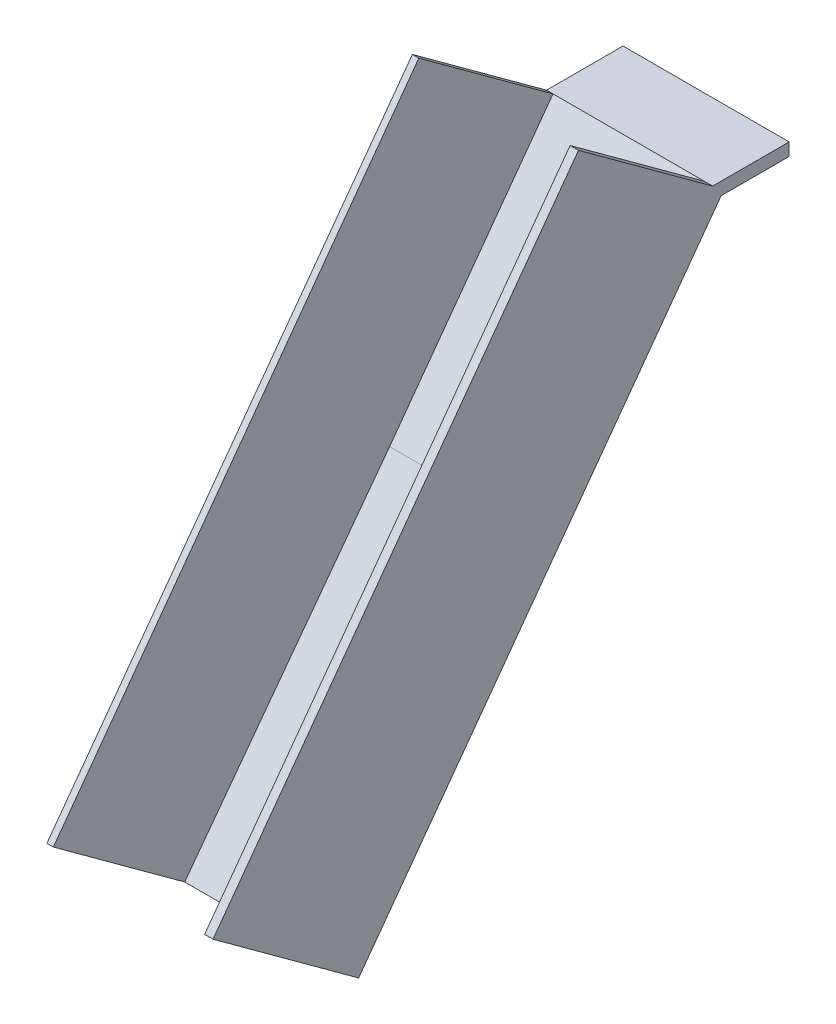
from build123d import *

# Parameters (mm, degrees)
BOSS_EXTRUDE1_DEPTH = 40
SKETCH4_W           = 1.560342198
SKETCH4_H           = 149.198591979
BOSS_EXTRUDE2_DEPTH = 40
SKETCH6_W           = 2.027300843
SKETCH6_H           = 149.198591979
BOSS_EXTRUDE3_DEPTH = 40


with BuildPart() as part:
    # Sketch3 → Boss-Extrude1 (new body)
    with BuildSketch(Plane(origin=(0, 0, 0), x_dir=(0, 0, -1), z_dir=(1, 0, 0))):
        Polygon((0, 0), (39.348289754, 53.871692839), (57.75585878, 53.871692839), (57.75585878, 50.831910798), (41.374811114, 50.831910798), (-45.883583059, -68.633444315), (-49.329231032, -66.116717112), align=None)
    extrude(amount=BOSS_EXTRUDE1_DEPTH)

    # Sketch4 → Boss-Extrude2 (add)
    with BuildSketch(Plane(origin=(0, 0, 0), x_dir=(1, 0, 0), z_dir=(0, 0.5898261654750604, 0.8075302437190738))):
        with Locations((0.780171099, -7.887623879)):
            Rectangle(SKETCH4_W, SKETCH4_H)
    extrude(amount=BOSS_EXTRUDE2_DEPTH)

    # Sketch6 → Boss-Extrude3 (add)
    with BuildSketch(Plane(origin=(0, 0, 0), x_dir=(1, 0, 0), z_dir=(0, 0.5898261654750604, 0.8075302437190738))):
        with Locations((38.986349578, -7.887623879)):
            Rectangle(SKETCH6_W, SKETCH6_H)
    extrude(amount=BOSS_EXTRUDE3_DEPTH)


solid = part.part
